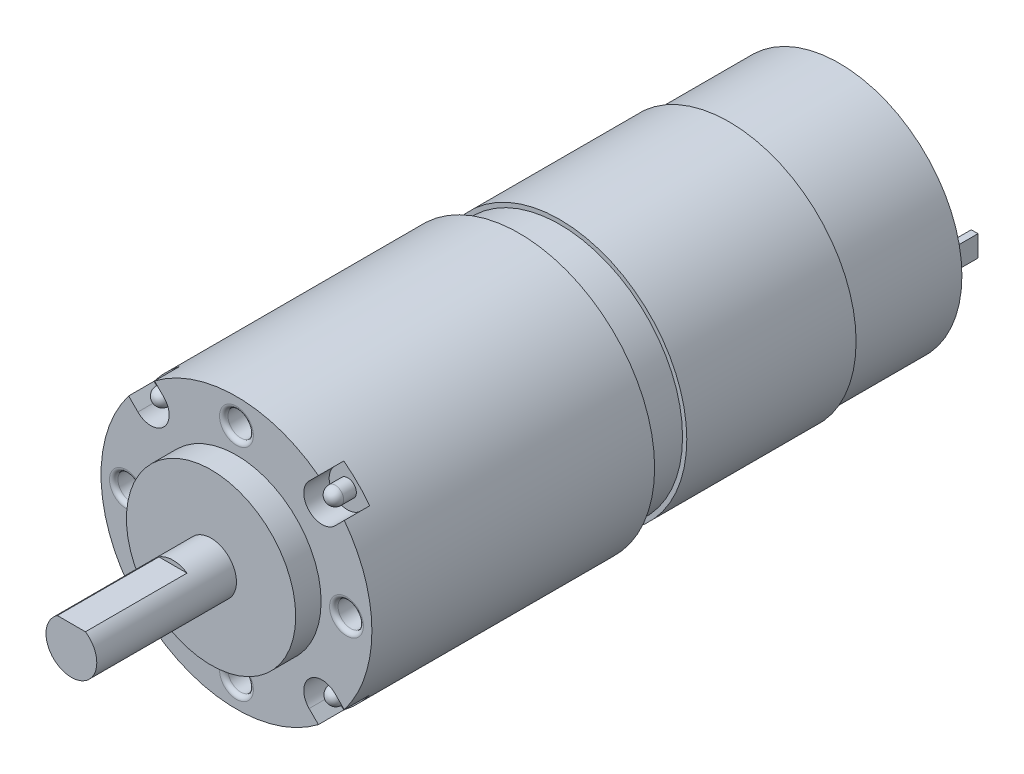
from build123d import *

# Parameters (mm, degrees)
ENL_V_MAT_EXTRU_1_DEPTH = 12
ESQUISSE3_W             = 0.8
ESQUISSE3_H             = 2.5
BOSS_EXTRU_1_DEPTH      = 4
ESQUISSE4_R             = 1.5
ENL_V_MAT_EXTRU_2_DEPTH = 4
CONG_2_R                = 0.5
ENL_V_MAT_EXTRU_3_DEPTH = 3
ESQUISSE6_R             = 1.00558737
BOSS_EXTRU_2_DEPTH      = 2.5
CONG_3_R                = 1


with BuildPart() as part:
    # Esquisse1 → Révolution1 (revolve)
    with BuildSketch(Plane(origin=(0, 0, 0), x_dir=(0, 0, -1), z_dir=(1, 0, 0)), mode=Mode.PRIVATE) as r_volution1_sk:
        with BuildLine():
            Line((61.773856141, 0), (61.773856141, 3.884381115))
            Line((61.773856141, 3.884381115), (59.773856141, 3.884381115))
            Line((59.773856141, 3.884381115), (59.773856141, 14.5))
            Line((59.773856141, 14.5), (46.773856141, 14.5))
            Line((46.773856141, 14.5), (46.773856141, 15))
            Line((46.773856141, 15), (26.773856141, 15))
            Line((26.773856141, 15), (26.773856141, 14.5))
            Line((26.773856141, 14.5), (22.973856141, 14.5))
            ThreePointArc((22.973856141, 14.5), (22.266749359, 14.207106781), (21.973856141, 13.5))
            Line((21.973856141, 13.5), (21.973856141, 14.5))
            Line((21.973856141, 14.5), (21.973856141, 16))
            Line((21.973856141, 16), (-11.426143859, 16))
            Line((-11.426143859, 16), (-11.426143859, 10))
            Line((-11.426143859, 10), (-14.426143859, 10))
            Line((-14.426143859, 10), (-14.426143859, 3))
            Line((-14.426143859, 3), (-30.926143859, 3))
            Line((-30.926143859, 3), (-30.926143859, 0))
            Line((-30.926143859, 0), (61.773856141, 0))
        make_face()
    revolve(r_volution1_sk.sketch.rotate(Axis((0, 0, 20.6), (0, 0, -1)), 90), axis=Axis((0, 0, 20.6), (0, 0, -1)))

    # Esquisse2 → Enlèv. mat.-Extru.1 (cut)
    with BuildSketch(Plane.XY.offset(30.926143859)):
        with BuildLine():
            Line((-1.658312395, 2.5), (1.658312395, 2.5))
            ThreePointArc((1.658312395, 2.5), (0, 3), (-1.658312395, 2.5))
        make_face()
    extrude(amount=-ENL_V_MAT_EXTRU_1_DEPTH, mode=Mode.SUBTRACT)

    # Esquisse3 → Boss.-Extru.1 (add)
    with BuildSketch(Plane(origin=(0, 0, -59.773856141), x_dir=(-1, 0, 0), z_dir=(0, 0, -1))):
        with Locations((-12, 0)):
            Rectangle(ESQUISSE3_W, ESQUISSE3_H)
        with Locations((12, 0)):
            Rectangle(ESQUISSE3_W, ESQUISSE3_H)
    extrude(amount=BOSS_EXTRU_1_DEPTH)

    # Esquisse4 → Enlèv. mat.-Extru.2 (cut)
    with BuildSketch(Plane.XY.offset(11.426143859)):
        with Locations((13, 0)):
            Circle(ESQUISSE4_R)
        with Locations((0, -13)):
            Circle(ESQUISSE4_R)
        with Locations((-13, 0)):
            Circle(ESQUISSE4_R)
        with Locations((0, 13)):
            Circle(ESQUISSE4_R)
    extrude(amount=-ENL_V_MAT_EXTRU_2_DEPTH, mode=Mode.SUBTRACT)

    # Congé2
    cong_2_edges = [part.edges().sort_by_distance(p)[0] for p in [
        (11.5, 0, 11.426143859),
        (-1.5, -13, 11.426143859),
        (-14.5, 0, 11.426143859),
        (-1.5, 13, 11.426143859),
    ]]
    fillet(cong_2_edges, radius=CONG_2_R)

    # Esquisse5 → Enlèv. mat.-Extru.3 (cut)
    with BuildSketch(Plane.XY.offset(11.426143859)):
        with BuildLine():
            Line((-11.64124723, 8.583366209), (-14.238773212, 11.18089219))
            ThreePointArc((-14.238773212, 11.18089219), (-14.238773212, 14.238773212), (-11.18089219, 14.238773212))
            Line((-11.18089219, 14.238773212), (-8.583366209, 11.64124723))
            ThreePointArc((-8.583366209, 11.64124723), (-8.583366209, 8.583366209), (-11.64124723, 8.583366209))
        make_face()
        with BuildLine():
            Line((8.583366209, 11.64124723), (11.18089219, 14.238773212))
            ThreePointArc((11.18089219, 14.238773212), (14.238773212, 14.238773212), (14.238773212, 11.18089219))
            Line((14.238773212, 11.18089219), (11.64124723, 8.583366209))
            ThreePointArc((11.64124723, 8.583366209), (8.583366209, 8.583366209), (8.583366209, 11.64124723))
        make_face()
        with BuildLine():
            Line((11.64124723, -8.583366209), (14.238773212, -11.18089219))
            ThreePointArc((14.238773212, -11.18089219), (14.238773212, -14.238773212), (11.18089219, -14.238773212))
            Line((11.18089219, -14.238773212), (8.583366209, -11.64124723))
            ThreePointArc((8.583366209, -11.64124723), (8.583366209, -8.583366209), (11.64124723, -8.583366209))
        make_face()
        with BuildLine():
            Line((-8.583366209, -11.64124723), (-11.18089219, -14.238773212))
            ThreePointArc((-11.18089219, -14.238773212), (-14.238773212, -14.238773212), (-14.238773212, -11.18089219))
            Line((-14.238773212, -11.18089219), (-11.64124723, -8.583366209))
            ThreePointArc((-11.64124723, -8.583366209), (-8.583366209, -8.583366209), (-8.583366209, -11.64124723))
        make_face()
    extrude(amount=-ENL_V_MAT_EXTRU_3_DEPTH, mode=Mode.SUBTRACT)

    # Esquisse6 → Boss.-Extru.2 (add)
    with BuildSketch(Plane.XY.offset(8.426143859)):
        with Locations((-10.246357947, 10.159890792)):
            Circle(ESQUISSE6_R)
        with Locations((10.159890792, 10.246357947)):
            Circle(ESQUISSE6_R)
        with Locations((10.246357947, -10.159890792)):
            Circle(ESQUISSE6_R)
        with Locations((-10.159890792, -10.246357947)):
            Circle(ESQUISSE6_R)
    extrude(amount=BOSS_EXTRU_2_DEPTH)

    # Congé3
    cong_3_edges = [part.edges().sort_by_distance(p)[0] for p in [
        (-11.251945317, 10.159890792, 10.926143859),
        (9.154303422, 10.246357947, 10.926143859),
        (9.240770577, -10.159890792, 10.926143859),
        (-11.165478162, -10.246357947, 10.926143859),
    ]]
    fillet(cong_3_edges, radius=CONG_3_R)


solid = part.part
